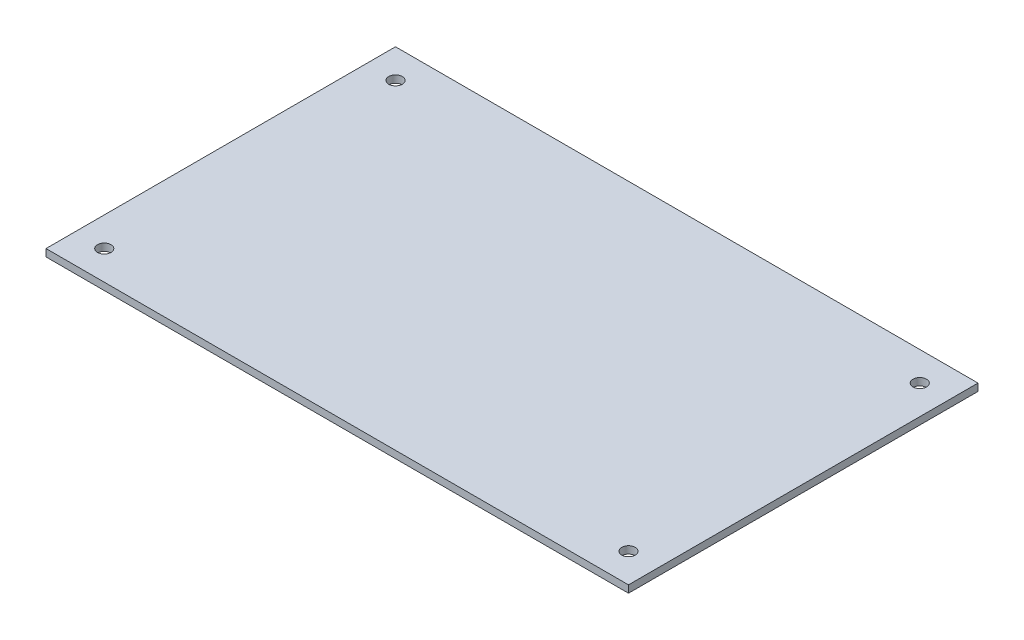
from build123d import *

# Parameters (mm, degrees)
SKETCH2_W                   = 127
SKETCH2_H                   = 76.2
BOSS_EXTRUDE1_DEPTH         = 1.5875
F_32_0_116_DIAMETER_HOLE3_D = 2.9464


with BuildPart() as part:
    # Sketch2 → Boss-Extrude1 (new body)
    with BuildSketch(Plane(origin=(0, 0, 0), x_dir=(1, 0, 0), z_dir=(0, 1, 0))):
        with Locations((50.8, 165.1)):
            Rectangle(SKETCH2_W, SKETCH2_H)
    extrude(amount=BOSS_EXTRUDE1_DEPTH)

    # #32 (0.116) Diameter Hole3 (through all)
    with Locations(Plane(origin=(0, 1.5875, 0), x_dir=(1, 0, 0), z_dir=(0, 1, 0))):
        with Locations((-6.35, 196.85), (-6.35, 133.35), (107.95, 133.35), (107.95, 196.85)):
            Hole(F_32_0_116_DIAMETER_HOLE3_D / 2)


solid = part.part
